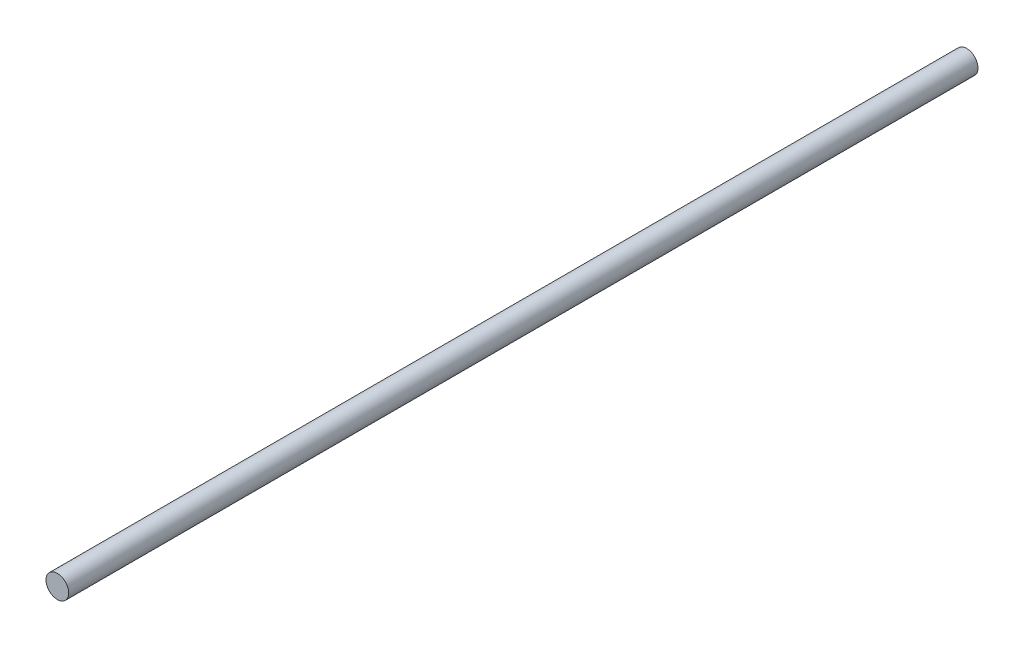
from build123d import *

# Parameters (mm, degrees)
SKETCH1_R           = 3.175
BOSS_EXTRUDE1_DEPTH = 127


with BuildPart() as part:
    # Sketch1 → Boss-Extrude1 (new, symmetric)
    with BuildSketch(Plane.XY):
        Circle(SKETCH1_R)
    extrude(amount=BOSS_EXTRUDE1_DEPTH, both=True)


solid = part.part
